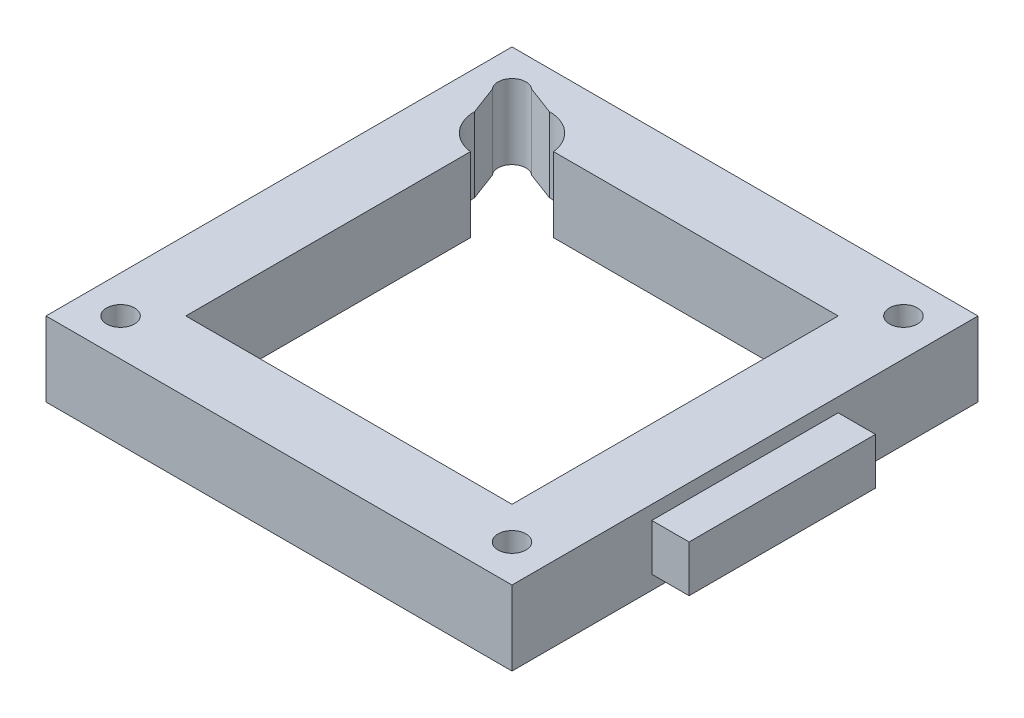
from build123d import *

# Parameters (mm, degrees)
SKETCH1_W        = 50
SKETCH1_H        = 50
SKETCH1_R        = 1.5
SUPPORT_DEPTH    = 8
NORTH_START      = -25
SKETCH2_W        = 20
SKETCH2_H        = 5
NORTH_CUT_DEPTH  = 4
WEST_START       = -25
SKETCH3_W        = 20
SKETCH3_H        = 5
WEST_CUT_DEPTH   = 4
EAST_START       = 25
SKETCH3_3_W      = 20
SKETCH3_3_H      = 5
EAST_DOWEL_DEPTH = 4


with BuildPart() as part:
    # Sketch1 → Support (new body)
    with BuildSketch(Plane(origin=(0, 0, 0), x_dir=(1, 0, 0), z_dir=(0, 1, 0))):
        Rectangle(SKETCH1_W, SKETCH1_H)
        with Locations(Location((-21, -21, 0), (0, 0, 270))):
            Circle(SKETCH1_R, mode=Mode.SUBTRACT)
        with Locations(Location((21, -21, 0), (0, 0, 270))):
            Circle(SKETCH1_R, mode=Mode.SUBTRACT)
        with BuildLine():
            Line((-13.031373033, 17.5), (17.5, 17.5))
            Line((17.5, 17.5), (17.5, -17.5))
            Line((17.5, -17.5), (-17.5, -17.5))
            Line((-17.5, -17.5), (-17.5, 13.031373033))
            ThreePointArc((-17.5, 13.031373033), (-20, 14.354248689), (-21, 17))
            Line((-21, 17), (-22.130136986, 20.01369863))
            ThreePointArc((-22.130136986, 20.01369863), (-22.060660172, 22.060660172), (-20.01369863, 22.130136986))
            Line((-20.01369863, 22.130136986), (-17, 21))
            ThreePointArc((-17, 21), (-14.354248689, 20), (-13.031373033, 17.5))
        make_face(mode=Mode.SUBTRACT)
        with Locations(Location((21, 21, 0), (0, 0, 270))):
            Circle(SKETCH1_R, mode=Mode.SUBTRACT)
    extrude(amount=SUPPORT_DEPTH)

    # Sketch2 → North Cut (cut)
    with BuildSketch(Plane.XY.offset(NORTH_START)):
        with Locations((0, 4)):
            Rectangle(SKETCH2_W, SKETCH2_H)
    extrude(amount=NORTH_CUT_DEPTH, mode=Mode.SUBTRACT)

    # Sketch3 → West Cut (cut)
    with BuildSketch(Plane(origin=(0, 0, 0), x_dir=(0, 0, -1), z_dir=(1, 0, 0)).offset(WEST_START)):
        with Locations((0, 4)):
            Rectangle(SKETCH3_W, SKETCH3_H)
    extrude(amount=WEST_CUT_DEPTH, mode=Mode.SUBTRACT)

    # Sketch3<3> → East Dowel (add)
    with BuildSketch(Plane(origin=(0, 0, 0), x_dir=(0, 0, -1), z_dir=(1, 0, 0)).offset(EAST_START)):
        with Locations((0, 4)):
            Rectangle(SKETCH3_3_W, SKETCH3_3_H)
    extrude(amount=EAST_DOWEL_DEPTH)


solid = part.part
